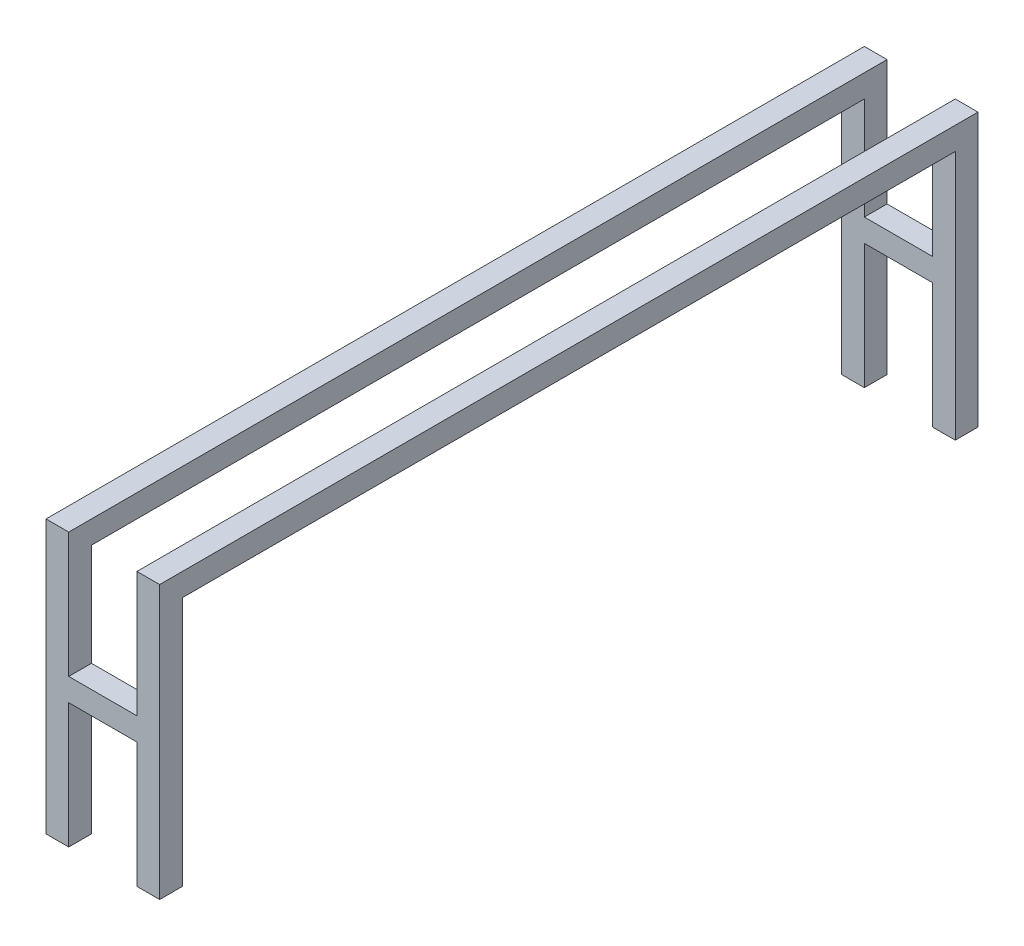
from build123d import *

# Parameters (mm, degrees)
SALIENTE_EXTRUIR1_DEPTH = 50
CROQUIS2_W              = 50
CROQUIS2_H              = 50
SALIENTE_EXTRUIR2_DEPTH = 150
SALIENTE_EXTRUIR3_DEPTH = 50


with BuildPart() as part:
    # Croquis1 → Saliente-Extruir1 (new body)
    with BuildSketch(Plane(origin=(0, 0, 0), x_dir=(0, 0, -1), z_dir=(1, 0, 0))):
        Polygon((0, 0), (0, 600), (-1800, 600), (-1800, 0), (-1750, 0), (-1750, 550), (-50, 550), (-50, 0), align=None)
    extrude(amount=SALIENTE_EXTRUIR1_DEPTH)

    # Croquis2 → Saliente-Extruir2 (add)
    with BuildSketch(Plane.ZY):
        with Locations((1775, 300)):
            Rectangle(CROQUIS2_W, CROQUIS2_H)
        with Locations((25, 300)):
            Rectangle(CROQUIS2_W, CROQUIS2_H)
    extrude(amount=SALIENTE_EXTRUIR2_DEPTH)

    # Croquis3 → Saliente-Extruir3 (add)
    with BuildSketch(Plane.ZY.offset(150)):
        Polygon((1750, 0), (1800, 0), (1800, 600), (0, 600), (0, 0), (50, 0), (50, 550), (1750, 550), align=None)
    extrude(amount=SALIENTE_EXTRUIR3_DEPTH)


solid = part.part
